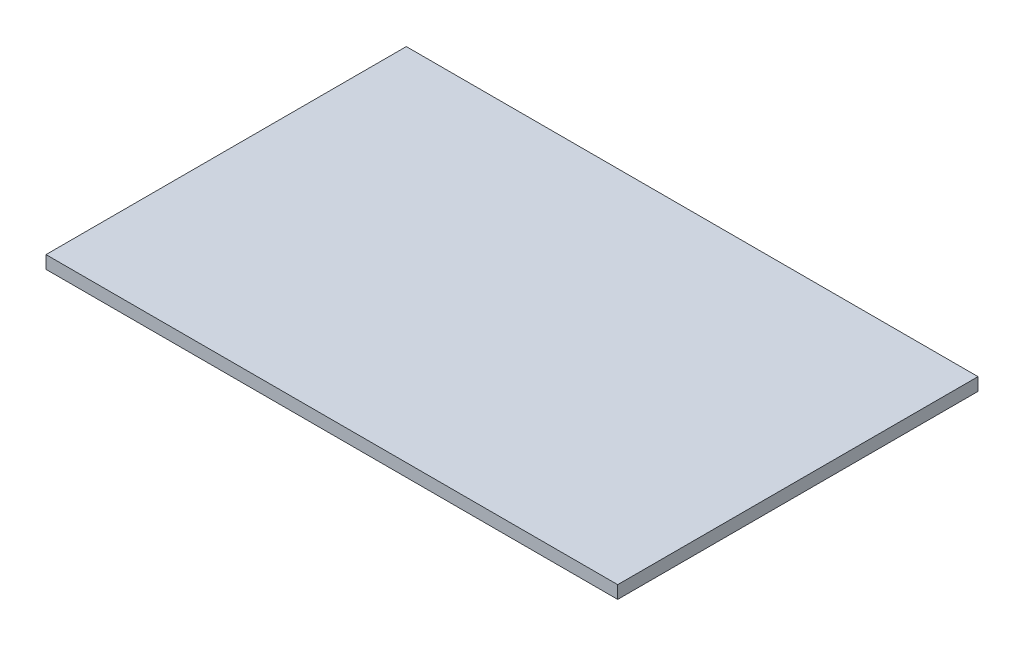
from build123d import *

# Parameters (mm, degrees)
SKIZZE1_W                       = 357
SKIZZE1_H                       = 225
AUFSATZ_LINEAR_AUSTRAGEN1_DEPTH = 8


with BuildPart() as part:
    # Skizze1 → Aufsatz-Linear austragen1 (new body)
    with BuildSketch(Plane(origin=(0, 0, 0), x_dir=(1, 0, 0), z_dir=(0, 1, 0))):
        Rectangle(SKIZZE1_W, SKIZZE1_H)
    extrude(amount=AUFSATZ_LINEAR_AUSTRAGEN1_DEPTH)


solid = part.part
